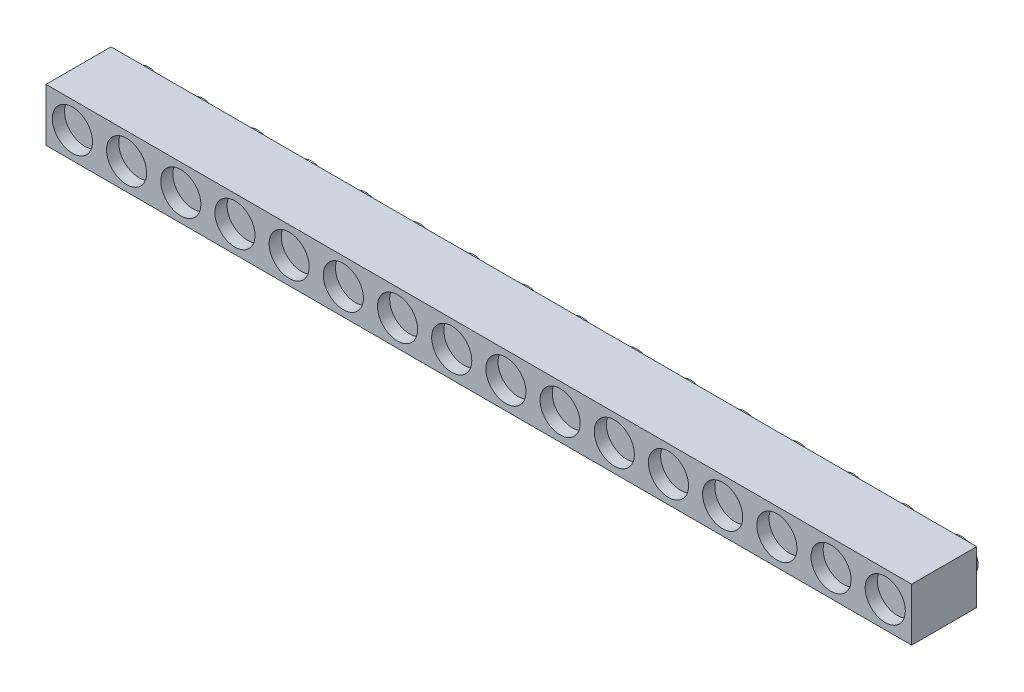
from build123d import *

# Parameters (mm, degrees)
SKETCH_1_W          = 127.8
SKETCH_1_H          = 7.8
EXTRUDE_1_DEPTH     = 9.6
SKETCH_2_R          = 2.4
EXTRUDE_2_DEPTH     = 1.7
SKETCH_3_R          = 2.962272449
CUT_EXTRUDE_1_DEPTH = 1.8


with BuildPart() as part:
    # Эскиз1 → Бобышка-Вытянуть1 (new body)
    with BuildSketch(Plane.XY):
        Rectangle(SKETCH_1_W, SKETCH_1_H)
    extrude(amount=EXTRUDE_1_DEPTH)

    # Эскиз2 → Бобышка-Вытянуть2 (add)
    with BuildSketch(Plane(origin=(0, 0, 0), x_dir=(-1, 0, 0), z_dir=(0, 0, -1))):
        with Locations((-60, 0)):
            Circle(SKETCH_2_R)
        with Locations((-52, 0)):
            Circle(SKETCH_2_R)
        with Locations((-44, 0)):
            Circle(SKETCH_2_R)
        with Locations((-36, 0)):
            Circle(SKETCH_2_R)
        with Locations((-28, 0)):
            Circle(SKETCH_2_R)
        with Locations((-20, 0)):
            Circle(SKETCH_2_R)
        with Locations((-12, 0)):
            Circle(SKETCH_2_R)
        with Locations((-4, 0)):
            Circle(SKETCH_2_R)
        with Locations((4, 0)):
            Circle(SKETCH_2_R)
        with Locations((12, 0)):
            Circle(SKETCH_2_R)
        with Locations((20, 0)):
            Circle(SKETCH_2_R)
        with Locations((28, 0)):
            Circle(SKETCH_2_R)
        with Locations((36, 0)):
            Circle(SKETCH_2_R)
        with Locations((44, 0)):
            Circle(SKETCH_2_R)
        with Locations((52, 0)):
            Circle(SKETCH_2_R)
        with Locations((60, 0)):
            Circle(SKETCH_2_R)
    extrude(amount=EXTRUDE_2_DEPTH)

    # Эскиз3 → Вырез-Вытянуть1 (cut)
    with BuildSketch(Plane.XY.offset(9.6)):
        with Locations((60, 0)):
            Circle(SKETCH_3_R)
        with Locations((52, 0)):
            Circle(SKETCH_3_R)
        with Locations((44, 0)):
            Circle(SKETCH_3_R)
        with Locations((36, 0)):
            Circle(SKETCH_3_R)
        with Locations((28, 0)):
            Circle(SKETCH_3_R)
        with Locations((20, 0)):
            Circle(SKETCH_3_R)
        with Locations((12, 0)):
            Circle(SKETCH_3_R)
        with Locations((4, 0)):
            Circle(SKETCH_3_R)
        with Locations((-4, 0)):
            Circle(SKETCH_3_R)
        with Locations((-12, 0)):
            Circle(SKETCH_3_R)
        with Locations((-20, 0)):
            Circle(SKETCH_3_R)
        with Locations((-28, 0)):
            Circle(SKETCH_3_R)
        with Locations((-36, 0)):
            Circle(SKETCH_3_R)
        with Locations((-44, 0)):
            Circle(SKETCH_3_R)
        with Locations((-52, 0)):
            Circle(SKETCH_3_R)
        with Locations((-60, 0)):
            Circle(SKETCH_3_R)
    extrude(amount=-CUT_EXTRUDE_1_DEPTH, mode=Mode.SUBTRACT)


solid = part.part
